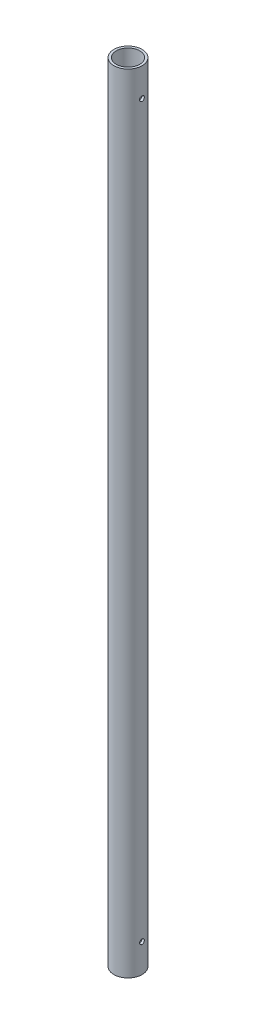
from build123d import *

# Parameters (mm, degrees)
SKETCH2_R               = 21.082
SKETCH2_R_2             = 17.526
BOSS_EXTRUDE1_DEPTH     = 587.375
F_1_4_CLEARANCE_HOLE1_D = 7.14248


with BuildPart() as part:
    # Sketch2 → Boss-Extrude1 (new, symmetric)
    with BuildSketch(Plane(origin=(0, 0, 0), x_dir=(1, 0, 0), z_dir=(0, 1, 0))):
        with Locations(Location((0, 0, 0), (0, 0, 270))):
            Circle(SKETCH2_R)
        with Locations(Location((0, 0, 0), (0, 0, 270))):
            Circle(SKETCH2_R_2, mode=Mode.SUBTRACT)
    extrude(amount=BOSS_EXTRUDE1_DEPTH, both=True)

    # 1/4 Clearance Hole1 (through all)
    with Locations(Plane(origin=(21.082, 544.83, 0), x_dir=(0, 0, 1), z_dir=(1, 0, 0))):
        with Locations((0, 0), (0, 1089.66)):
            Hole(F_1_4_CLEARANCE_HOLE1_D / 2)


solid = part.part
